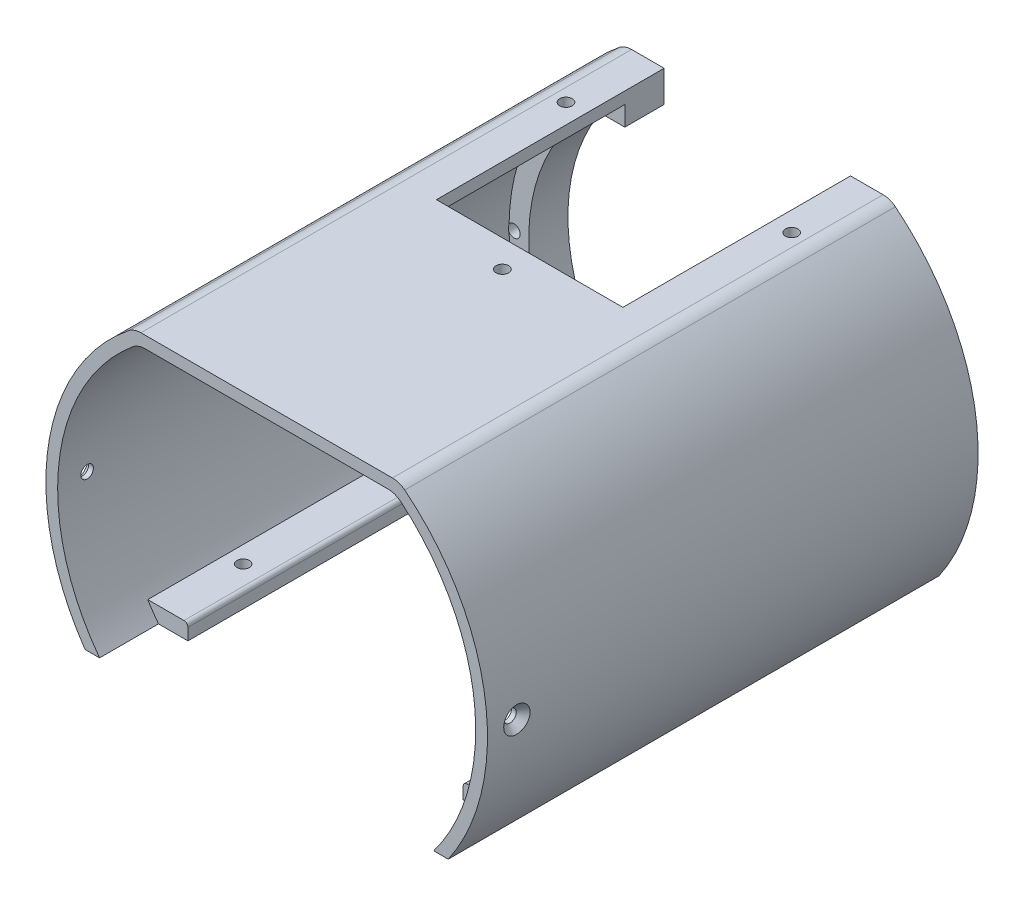
from build123d import *

# Parameters (mm, degrees)
Y_KSEKLIK_EKSTR_ZYON2_DEPTH             = 62.5
KES_EKSTR_ZYON5_DEPTH                   = 15
KES_EKSTR_ZYON6_DEPTH                   = 15
M3_BO_LUKLU_DELIK1_D                    = 3.2
M3_BO_LUKLU_DELIK1_DEPTH                = 11.5
M3_BO_LUKLU_DELIK1_TIP                  = 0.9613769904440965
M3X0_5_HELISARMAL_IN_DI_LI_DELIK2_D     = 3.15
M3X0_5_HELISARMAL_IN_DI_LI_DELIK2_DEPTH = 11
M3X0_5_HELISARMAL_IN_DI_LI_DELIK2_TIP   = 0.9463554749684074
RADYUS1_R                               = 1
Y_KSEKLIK_EKSTR_ZYON3_DEPTH             = 10
M3X0_5_HELISARMAL_IN_DI_LI_DELIK1_D     = 3.15
M3X0_5_HELISARMAL_IN_DI_LI_DELIK1_DEPTH = 10
M3X0_5_HELISARMAL_IN_DI_LI_DELIK1_TIP   = 0.9463554749684074
DAIRESEL_KAPLAMA1_COUNT                 = 2
DAIRESEL_KAPLAMA1_ANGLE                 = 180.0000000000004


with BuildPart() as part:
    # Çizim1 → Yükseklik-Ekstrüzyon2 (new, symmetric)
    with BuildSketch(Plane.XY):
        with BuildLine():
            Line((32.04001404494075, 45), (-32.04001404494075, 45))
            ThreePointArc((-32.04001404494075, 45), (-33.696486936063444, 44.7176368619231), (-35.165869073715456, 43.90243902439025))
            ThreePointArc((-35.165869073715456, 43.90243902439025), (-55.65852190175254, 8.135812172864675), (-46.260809547607366, -32))
            Line((-46.260809547607366, -32), (-35.06245411157585, -32))
            Line((-35.06245411157585, -32), (-35.06245411157585, -28))
            Line((-35.06245411157585, -28), (-45.2941773299836, -28.000000000000007))
            ThreePointArc((-45.2941773299836, -28.000000000000007), (-52.56891292419714, 8.48951670992989), (-34.1779294904093, 40.83419689119171))
            ThreePointArc((-34.1779294904093, 40.83419689119171), (-32.67592718411632, 41.69952042531781), (-30.968734233093876, 41.99999999999999))
            Line((-30.968734233093876, 41.99999999999999), (30.968734233093905, 41.99999999999997))
            ThreePointArc((30.968734233093905, 41.99999999999997), (32.675927184116354, 41.699520425317786), (34.17792949040933, 40.83419689119169))
            ThreePointArc((34.17792949040933, 40.83419689119169), (52.56891292419713, 8.489516709929875), (45.2941773299836, -27.99999999999998))
            Line((45.2941773299836, -27.99999999999998), (35.06245411157585, -27.99999999999998))
            Line((35.06245411157585, -27.99999999999998), (35.06245411157587, -31.999999999999957))
            Line((35.06245411157587, -31.999999999999957), (46.260809547607366, -32))
            ThreePointArc((46.260809547607366, -32), (55.65852190175254, 8.13581217286468), (35.165869073715456, 43.90243902439025))
            ThreePointArc((35.165869073715456, 43.90243902439025), (33.696486936063444, 44.7176368619231), (32.04001404494075, 45))
        make_face()
    extrude(amount=Y_KSEKLIK_EKSTR_ZYON2_DEPTH, both=True)

    # Çizim3 → Kes-Ekstrüzyon5 (cut)
    with BuildSketch(Plane.XY.offset(62.5)):
        with BuildLine():
            Line((-42.56245411157586, -31.99999999999998), (-42.56245411157586, -32.283572214894534))
            Line((-42.56245411157586, -32.283572214894534), (-35.06245411157585, -32.283572214894534))
            Line((-35.06245411157585, -32.283572214894534), (-35.06245411157585, -32))
            Line((-35.06245411157585, -32), (-35.06245411157585, -28))
            Line((-35.06245411157585, -28), (-45.2941773299836, -28.000000000000007))
            ThreePointArc((-45.2941773299836, -28.000000000000007), (-43.97382087179262, -30.031076869394756), (-42.56245411157586, -31.99999999999998))
        make_face()
        with BuildLine():
            Line((35.06245411157585, -27.99999999999998), (45.294177329983604, -27.99999999999998))
            ThreePointArc((45.294177329983604, -27.99999999999998), (43.97389225931995, -30.030972337999984), (42.56260624715447, -31.999797647011572))
            Line((42.56260624715447, -31.999797647011572), (42.56260624715447, -32.40361379134536))
            Line((42.56260624715447, -32.40361379134536), (35.06245411157587, -32.40361379134536))
            Line((35.06245411157587, -32.40361379134536), (35.06245411157587, -31.999999999999957))
            Line((35.06245411157587, -31.999999999999957), (35.06245411157585, -27.99999999999998))
        make_face()
    extrude(amount=-KES_EKSTR_ZYON5_DEPTH, mode=Mode.SUBTRACT)

    # Çizim4 → Kes-Ekstrüzyon6 (cut)
    with BuildSketch(Plane(origin=(0, 45, 0), x_dir=(1, 0, 0), z_dir=(0, 1, 0))):
        Polygon((23.75, 62.49999999999993), (-23.75, 62.5), (-23.749999999999993, 4.499999999999997), (23.749999999999993, 4.499999999999997), align=None)
    extrude(amount=-KES_EKSTR_ZYON6_DEPTH, mode=Mode.SUBTRACT)

    # M3 Boşluklu Delik1
    with Locations(Plane(origin=(0, 45, 0), x_dir=(1, 0, 0), z_dir=(0, 1, 0))):
        with Locations((0, -2.45), (-28.75, 42.5), (28.75, 42.5)):
            Hole(M3_BO_LUKLU_DELIK1_D / 2, depth=M3_BO_LUKLU_DELIK1_DEPTH)
            with Locations((0, 0, -(M3_BO_LUKLU_DELIK1_DEPTH + M3_BO_LUKLU_DELIK1_TIP / 2))):  # 118° drill point
                Cone(0, M3_BO_LUKLU_DELIK1_D / 2, M3_BO_LUKLU_DELIK1_TIP, mode=Mode.SUBTRACT)

    # M3x0.5 Helisarmal İçin Dişli Delik2
    with Locations(Plane.XZ.offset(32)):
        with Locations((41.000809548, -27.5), (-41.000809548, -27.5), (-41.000809548, 27.5), (41.000809548, 27.5)):
            Hole(M3X0_5_HELISARMAL_IN_DI_LI_DELIK2_D / 2, depth=M3X0_5_HELISARMAL_IN_DI_LI_DELIK2_DEPTH)
            with Locations((0, 0, -(M3X0_5_HELISARMAL_IN_DI_LI_DELIK2_DEPTH + M3X0_5_HELISARMAL_IN_DI_LI_DELIK2_TIP / 2))):  # 118° drill point
                Cone(0, M3X0_5_HELISARMAL_IN_DI_LI_DELIK2_D / 2, M3X0_5_HELISARMAL_IN_DI_LI_DELIK2_TIP, mode=Mode.SUBTRACT)

    # Radyus1
    radyus1_edges = [part.edges().sort_by_distance(p)[0] for p in [
        (35.06245411157585, -27.99999999999998, -7.5),
        (-35.06245411157585, -28, -7.5),
    ]]
    fillet(radyus1_edges, radius=RADYUS1_R)

    # Çizim14 → Yükseklik-Ekstrüzyon3 (add)
    with BuildSketch(Plane(origin=(0, 0, -62.5), x_dir=(-1, 0, 0), z_dir=(0, 0, -1))):
        with BuildLine():
            Line((36.06245411157586, -23), (42.41535688874963, -23.000000000000004))
            ThreePointArc((42.41535688874963, -23.000000000000004), (47.39521291696829, 9.04191863241662), (30.968734233093883, 37))
            Line((30.968734233093883, 37), (23.75000000000001, 36.999999999999986))
            Line((23.75000000000001, 36.999999999999986), (23.749999999999996, 42.999999999999986))
            Line((23.749999999999996, 42.999999999999986), (30.968734233093873, 43))
            ThreePointArc((30.968734233093873, 43), (33.0173657743208, 42.63942451038137), (34.81976854187237, 41.60103626943006))
            ThreePointArc((34.81976854187237, 41.60103626943006), (53.59999153018334, 8.372777792601147), (45.848255146733784, -29.000000000000004))
            Line((45.848255146733784, -29.000000000000004), (36.06245411157585, -29))
            Line((36.06245411157585, -29), (36.06245411157586, -23))
        make_face()
        with BuildLine():
            Line((-23.75, 42.999999999999986), (-30.968734233093905, 42.99999999999998))
            ThreePointArc((-30.968734233093905, 42.99999999999998), (-33.01736577432084, 42.639424510381346), (-34.819768541872406, 41.601036269430026))
            ThreePointArc((-34.819768541872406, 41.601036269430026), (-53.59999153018334, 8.372777792601134), (-45.8482551467338, -28.999999999999982))
            Line((-45.8482551467338, -28.999999999999982), (-36.06245411157586, -28.999999999999982))
            Line((-36.06245411157586, -28.999999999999982), (-36.06245411157586, -22.99999999999998))
            Line((-36.06245411157586, -22.99999999999998), (-42.415356888749635, -22.99999999999998))
            ThreePointArc((-42.415356888749635, -22.99999999999998), (-47.39521291696828, 9.041918632416632), (-30.968734233093908, 36.99999999999998))
            Line((-30.968734233093908, 36.99999999999998), (-23.749999999999996, 36.999999999999986))
            Line((-23.749999999999996, 36.999999999999986), (-23.75, 42.999999999999986))
        make_face()
    extrude(amount=-Y_KSEKLIK_EKSTR_ZYON3_DEPTH)

    # M3x0.5 Helisarmal İçin Dişli Delik1
    with Locations(Plane(origin=(0, 0, -62.5), x_dir=(-1, 0, 0), z_dir=(0, 0, -1))):
        with Locations((36.769552622, 36.769552622), (-52, 0), (-36.769552622, 36.769552622), (-45.033320997, -26), (52, 0), (45.033320997, -26)):
            Hole(M3X0_5_HELISARMAL_IN_DI_LI_DELIK1_D / 2, depth=M3X0_5_HELISARMAL_IN_DI_LI_DELIK1_DEPTH)
            with Locations((0, 0, -(M3X0_5_HELISARMAL_IN_DI_LI_DELIK1_DEPTH + M3X0_5_HELISARMAL_IN_DI_LI_DELIK1_TIP / 2))):  # 118° drill point
                Cone(0, M3X0_5_HELISARMAL_IN_DI_LI_DELIK1_D / 2, M3X0_5_HELISARMAL_IN_DI_LI_DELIK1_TIP, mode=Mode.SUBTRACT)

    # Çizim22 → M3 Altıgen Alyan Havşa Başlı Kör Vida İçin Havşa3 (revolve, cut)
    with BuildSketch(Plane(origin=(56.25, -7e-17, 55), x_dir=(0, 0, -1), z_dir=(0, 1, 0))):
        Polygon((0, 0), (-1.4e-15, 9.961376990444082), (1.5999999999999868, 8.999999999999995), (1.5999999999999885, 1.7600000000000116), (3.3600000000000003, -1.73e-15), align=None)
    m3_alt_gen_alyan_hav_a_ba_l_k_r_vida_i = revolve(axis=Axis((62.599999999999994, -7e-17, 55), (-1, 0, 0)), mode=Mode.SUBTRACT)

    # Dairesel Kaplama1: M3 Altıgen Alyan Havşa Başlı Kör Vida İçin Havşa3 ×2 about axis
    dairesel_kaplama1_axis = Axis((0, 0, 62.5), (0, 0, 1))
    for i in range(1, DAIRESEL_KAPLAMA1_COUNT):
        add(m3_alt_gen_alyan_hav_a_ba_l_k_r_vida_i.rotate(dairesel_kaplama1_axis, i * DAIRESEL_KAPLAMA1_ANGLE / (DAIRESEL_KAPLAMA1_COUNT - 1)), mode=Mode.SUBTRACT)


solid = part.part
